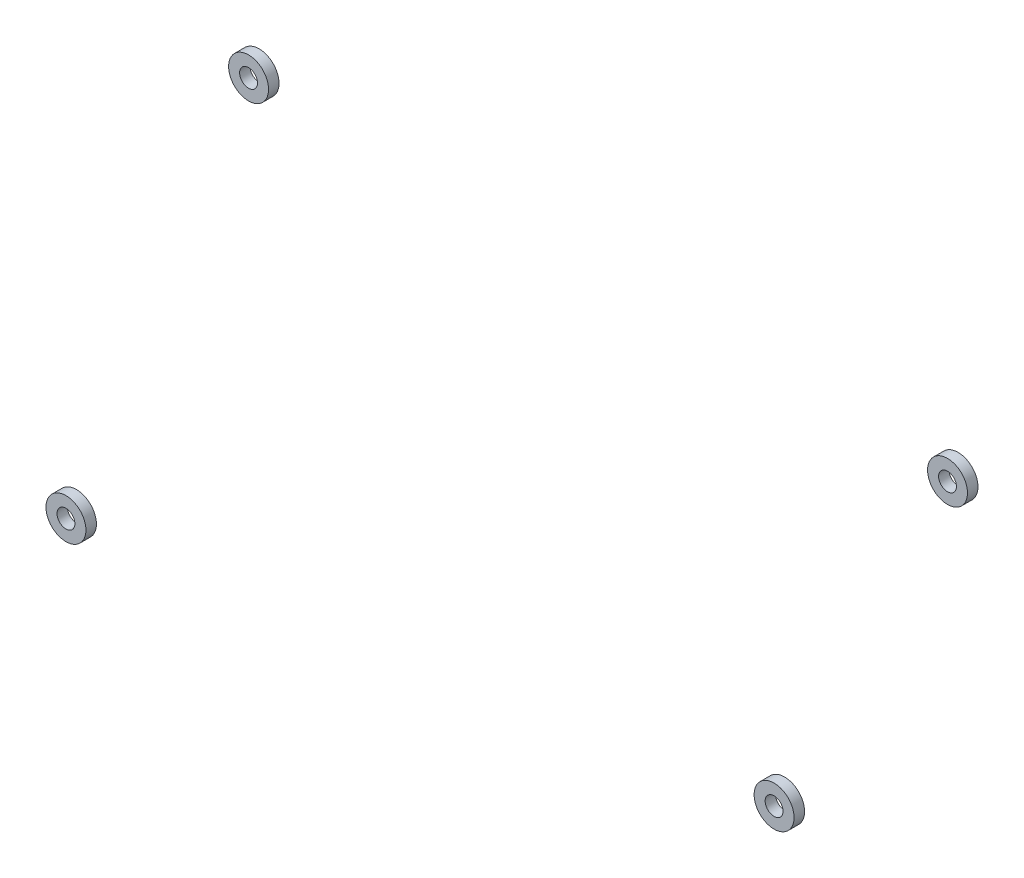
from build123d import *

# Parameters (mm, degrees)
SKETCH1_R             = 3.8
SKETCH1_R_2           = 1.7
BOSS_EXTRUDE1_DEPTH   = 2
BOSS_EXTRUDE1_2_DEPTH = 2
BOSS_EXTRUDE1_3_DEPTH = 2
BOSS_EXTRUDE1_4_DEPTH = 2


with BuildPart() as part:
    # Sketch1 → Boss-Extrude1 (new body)
    with BuildSketch(Plane.XY):
        with Locations((23.5, 38)):
            Circle(SKETCH1_R)
        with Locations((23.5, 38)):
            Circle(SKETCH1_R_2, mode=Mode.SUBTRACT)
    extrude(amount=BOSS_EXTRUDE1_DEPTH)


with BuildPart() as body_2:
    # Sketch1 → Boss-Extrude1 2 (new body)
    with BuildSketch(Plane.XY):
        with Locations((156.5, 38)):
            Circle(SKETCH1_R)
        with Locations((156.5, 38)):
            Circle(SKETCH1_R_2, mode=Mode.SUBTRACT)
    extrude(amount=BOSS_EXTRUDE1_2_DEPTH)


with BuildPart() as body_3:
    # Sketch1 → Boss-Extrude1 3 (new body)
    with BuildSketch(Plane.XY):
        with Locations((123.5, -32)):
            Circle(SKETCH1_R)
        with Locations((123.5, -32)):
            Circle(SKETCH1_R_2, mode=Mode.SUBTRACT)
    extrude(amount=BOSS_EXTRUDE1_3_DEPTH)


with BuildPart() as body_4:
    # Sketch1 → Boss-Extrude1 4 (new body)
    with BuildSketch(Plane.XY):
        with Locations((-11.25, -52)):
            Circle(SKETCH1_R)
        with Locations((-11.25, -52)):
            Circle(SKETCH1_R_2, mode=Mode.SUBTRACT)
    extrude(amount=BOSS_EXTRUDE1_4_DEPTH)


solid = Compound([part.part, body_2.part, body_3.part, body_4.part])
